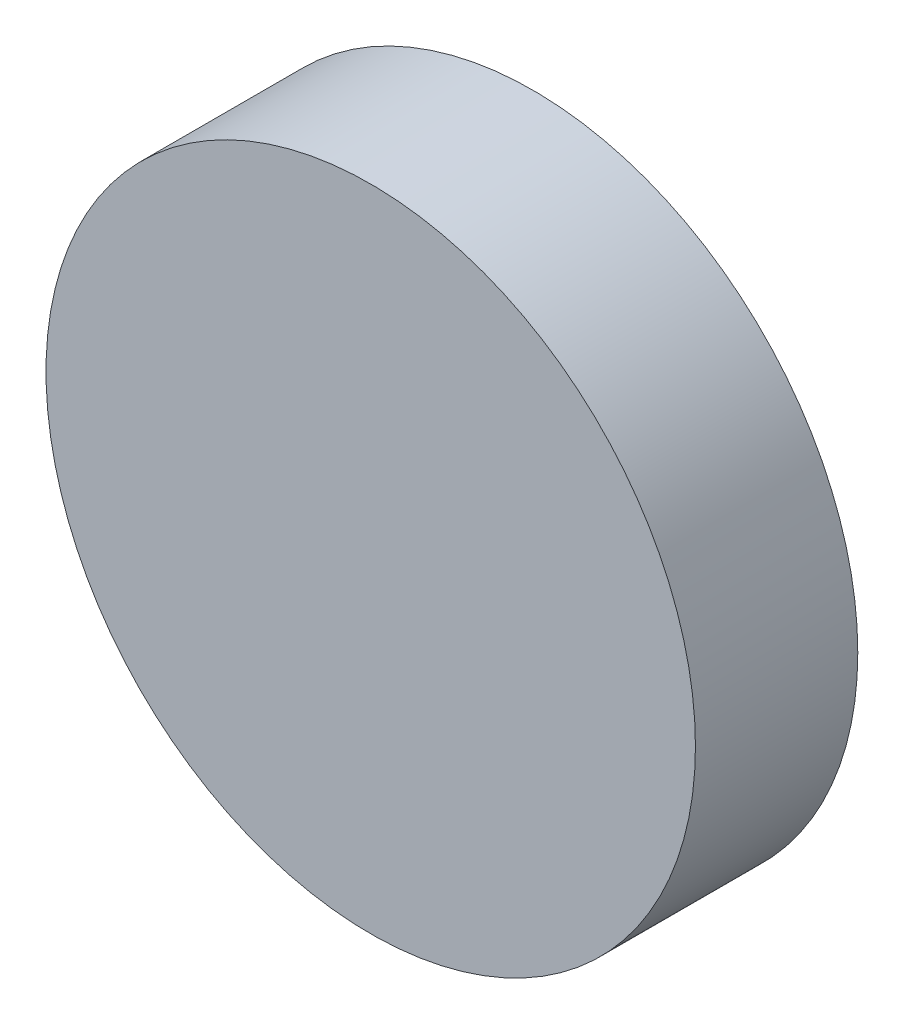
from build123d import *

# Parameters (mm, degrees)
SKETCH1_R           = 25.4
BOSS_EXTRUDE1_DEPTH = 12.7


with BuildPart() as part:
    # Sketch1 → Boss-Extrude1 (new body)
    with BuildSketch(Plane.XY):
        with Locations((-30.291010944, 15.918155424)):
            Circle(SKETCH1_R)
    extrude(amount=BOSS_EXTRUDE1_DEPTH)


solid = part.part
